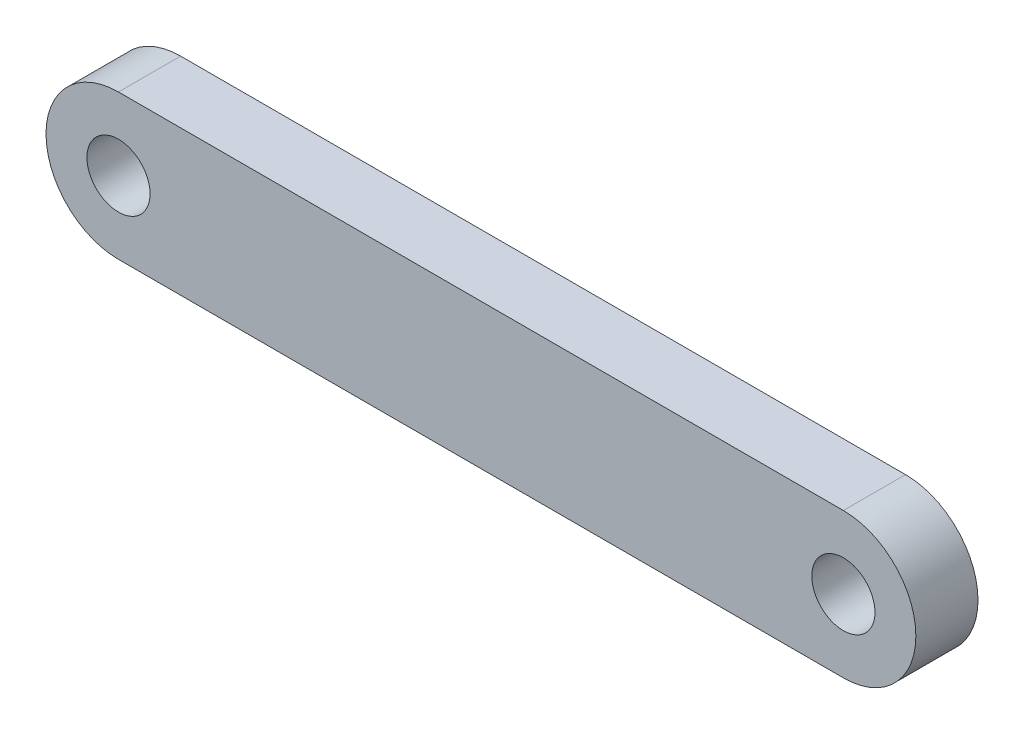
from build123d import *

# Parameters (mm, degrees)
SKETCH1_R           = 1.525
BOSS_EXTRUDE1_DEPTH = 1.5


with BuildPart() as part:
    # Sketch1 → Boss-Extrude1 (new, symmetric)
    with BuildSketch(Plane.XY):
        with BuildLine():
            Line((0, 3.5), (35, 3.5))
            ThreePointArc((35, 3.5), (38.5, 0), (35, -3.5))
            Line((35, -3.5), (0, -3.5))
            ThreePointArc((0, -3.5), (-3.5, 0), (0, 3.5))
        make_face()
        Circle(SKETCH1_R, mode=Mode.SUBTRACT)
        with Locations((35, 0)):
            Circle(SKETCH1_R, mode=Mode.SUBTRACT)
    extrude(amount=BOSS_EXTRUDE1_DEPTH, both=True)


solid = part.part
